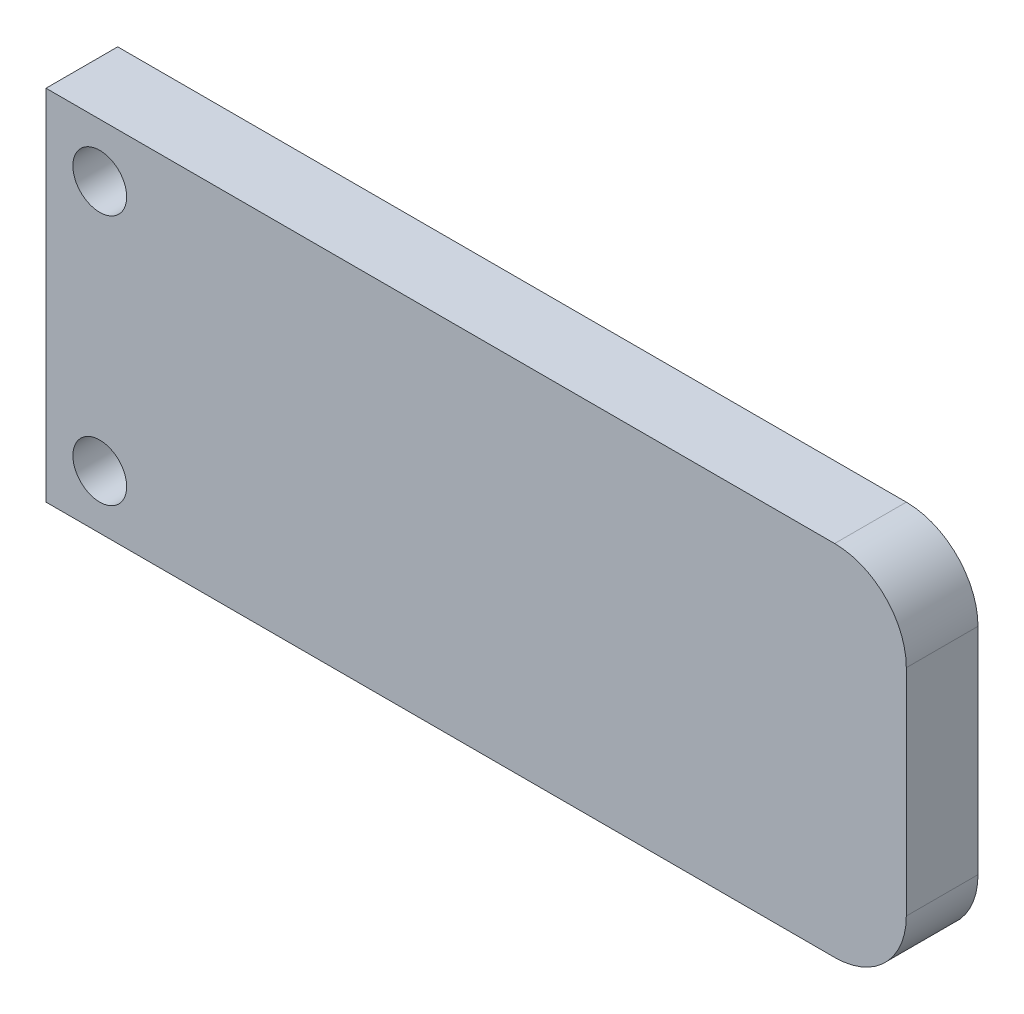
from build123d import *
from build123d.topology import SkipClean

# Parameters (mm, degrees)
SKETCH1_W           = 48
SKETCH1_H           = 20
BOSS_EXTRUDE1_DEPTH = 2
FILLET2_R           = 4
CUT_EXTRUDE1_REACH  = 28.306
SKETCH4_R           = 1.5
CUT_REVOLVE1_ANGLE  = 180


with BuildPart() as part:
    # Sketch1 → Boss-Extrude1 (new, symmetric)
    with BuildSketch(Plane.XY):
        Rectangle(SKETCH1_W, SKETCH1_H)
    extrude(amount=BOSS_EXTRUDE1_DEPTH, both=True)

    # Fillet2
    fillet2_edges = [part.edges().sort_by_distance(p)[0] for p in [
        (24, -10, 0),
        (24, 10, 0),
    ]]
    fillet(fillet2_edges, radius=FILLET2_R)

    # Sketch4 → Cut-Extrude1 (cut, up to next)
    with BuildSketch(Plane(origin=(0, 0, -2), x_dir=(-1, 0, 0), z_dir=(0, 0, -1)), mode=Mode.PRIVATE) as cut_extrude1_sk1:
        with Locations((21, 7)):
            Circle(SKETCH4_R)
    cut_extrude1_tool1 = extrude(cut_extrude1_sk1.sketch, amount=-CUT_EXTRUDE1_REACH, mode=Mode.PRIVATE) & part.part
    # Sketch4 → Cut-Extrude1 (cut, up to next)
    with BuildSketch(Plane(origin=(0, 0, -2), x_dir=(-1, 0, 0), z_dir=(0, 0, -1)), mode=Mode.PRIVATE) as cut_extrude1_sk2:
        with Locations((21, -7)):
            Circle(SKETCH4_R)
    cut_extrude1_tool2 = extrude(cut_extrude1_sk2.sketch, amount=-CUT_EXTRUDE1_REACH, mode=Mode.PRIVATE) & part.part
    add(cut_extrude1_tool1.solids().sort_by_distance((-21, 7, -2))[0], mode=Mode.SUBTRACT)
    add(cut_extrude1_tool2.solids().sort_by_distance((-21, -7, -2))[0], mode=Mode.SUBTRACT)

    # Sketch3 → Cut-Revolve1 (revolve, cut)
    with SkipClean():  # the faces are left unmerged after this step: merging them gives an invalid solid
        with BuildSketch(Plane.XY.offset(-2)):
            with BuildLine():
                ThreePointArc((19.25, 0), (16.5, 2.75), (13.75, 0))
                Line((13.75, 0), (19.25, 0))
            make_face()
            with BuildLine():
                Line((19.25, 0), (13.75, 0))
                ThreePointArc((13.75, 0), (16.5, -2.75), (19.25, 0))
            make_face()
        revolve(axis=Axis((13.75, 0, -2), (1, 0, 0)), revolution_arc=CUT_REVOLVE1_ANGLE, mode=Mode.SUBTRACT)


solid = part.part
